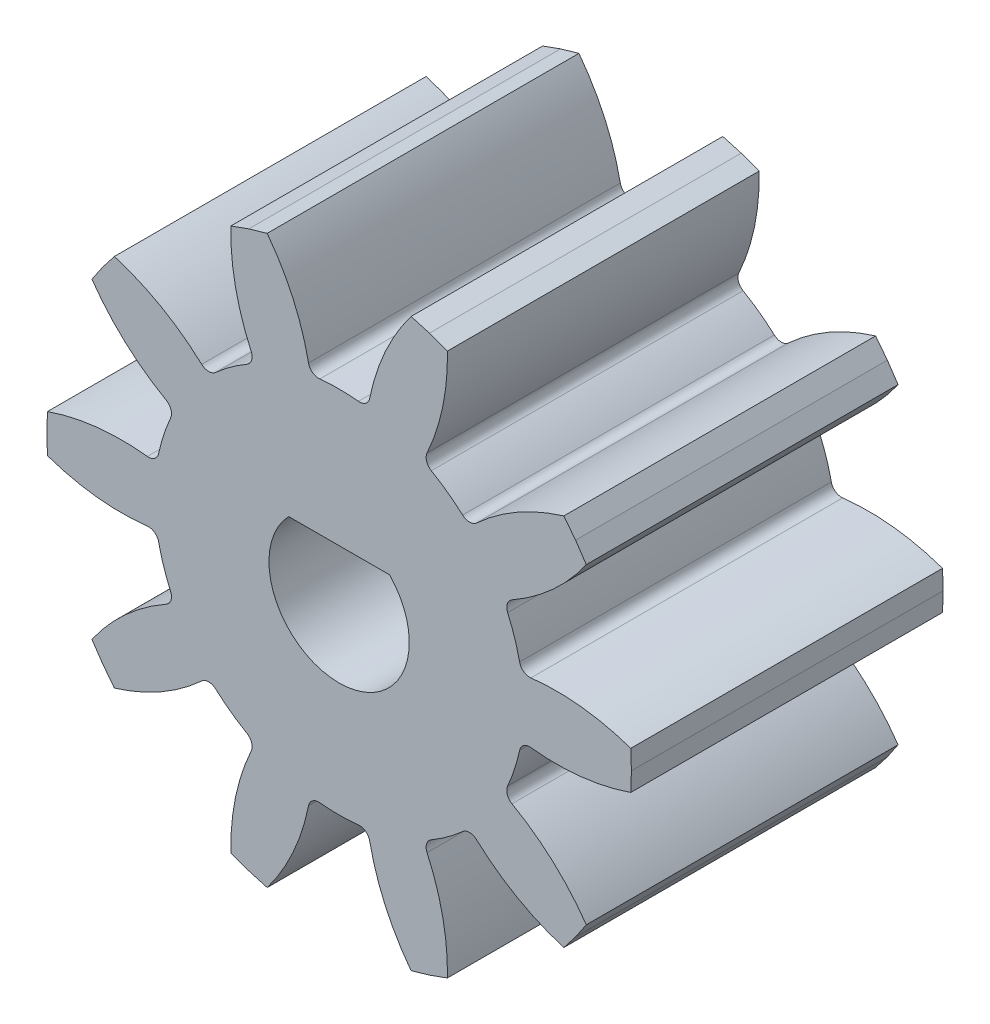
from build123d import *

# Parameters (mm, degrees)
BOSS_EXTRUDE1_DEPTH      = 10
FILLET1_R                = 0.3325
CIRPATTERN1_COUNT        = 10
FILLET1_OF_CIRPATTERN1_R = 0.3325
CUT_EXTRUDE1_REACH       = 18.446


with BuildPart() as part:
    # Sketch1 → Boss-Extrude1 (new body)
    with BuildSketch(Plane.XY):
        with BuildLine():
            Line((9.354927405, 0.613154337), (9.375, 0))
            Line((9.375, 0), (9.354927405, -0.613154337))
            ThreePointArc((9.354927405, -0.613154337), (7.619096435, -0.986300983), (5.844645755, -0.925700947))
            ThreePointArc((5.844645755, -0.925700947), (5.753999004, -1.381412941), (5.627876935, -1.828608064))
            Line((5.627876935, -1.828608064), (0, 0))
            Line((0, 0), (5.627876935, 1.828608064))
            ThreePointArc((5.627876935, 1.828608064), (5.753999004, 1.381412941), (5.844645755, 0.925700947))
            ThreePointArc((5.844645755, 0.925700947), (7.619096435, 0.986300983), (9.354927405, 0.613154337))
        make_face()
    boss_extrude1 = extrude(amount=BOSS_EXTRUDE1_DEPTH)

    # Fillet1
    fillet1_edges = [part.edges().sort_by_distance(p)[0] for p in [
        (5.844645755, 0.925700947, 5),
        (5.844645755, -0.925700947, 5),
    ]]
    fillet(fillet1_edges, radius=FILLET1_R)

    # CirPattern1: Boss-Extrude1 ×10 about axis
    cirpattern1_axis = Axis((0, 0, 0), (0, 0, 1))
    for i in range(1, CIRPATTERN1_COUNT):
        add(boss_extrude1.rotate(cirpattern1_axis, i * 360 / CIRPATTERN1_COUNT))

    # Fillet1 of CirPattern1
    fillet1_of_cirpattern1_edges = [part.edges().sort_by_distance(p)[0] for p in [
        (4.184304378, 4.184304378, 5),
        (5.272531107, 2.686488782, 5),
        (0.925700947, 5.844645755, 5),
        (2.686488782, 5.272531107, 5),
        (-2.686488782, 5.272531107, 5),
        (-0.925700947, 5.844645755, 5),
        (-5.272531107, 2.686488782, 5),
        (-4.184304378, 4.184304378, 5),
        (-5.844645755, -0.925700947, 5),
        (-5.844645755, 0.925700947, 5),
        (-4.184304378, -4.184304378, 5),
        (-5.272531107, -2.686488782, 5),
        (-0.925700947, -5.844645755, 5),
        (-2.686488782, -5.272531107, 5),
        (2.686488782, -5.272531107, 5),
        (0.925700947, -5.844645755, 5),
        (5.272531107, -2.686488782, 5),
        (4.184304378, -4.184304378, 5),
    ]]
    fillet(fillet1_of_cirpattern1_edges, radius=FILLET1_OF_CIRPATTERN1_R)

    # Sketch2 → Cut-Extrude1 (cut, up to next)
    with BuildSketch(Plane(origin=(0, 0, 0), x_dir=(-1, 0, 0), z_dir=(0, 0, -1)), mode=Mode.PRIVATE) as cut_extrude1_sk1:
        with BuildLine():
            Line((-1.616562711, 1.565), (1.616562711, 1.565))
            ThreePointArc((1.616562711, 1.565), (0, -2.25), (-1.616562711, 1.565))
        make_face()
    cut_extrude1_tool1 = extrude(cut_extrude1_sk1.sketch, amount=-CUT_EXTRUDE1_REACH, mode=Mode.PRIVATE) & part.part
    add(cut_extrude1_tool1.solids().sort_by_distance((0, -0.195905, 0))[0], mode=Mode.SUBTRACT)


solid = part.part
